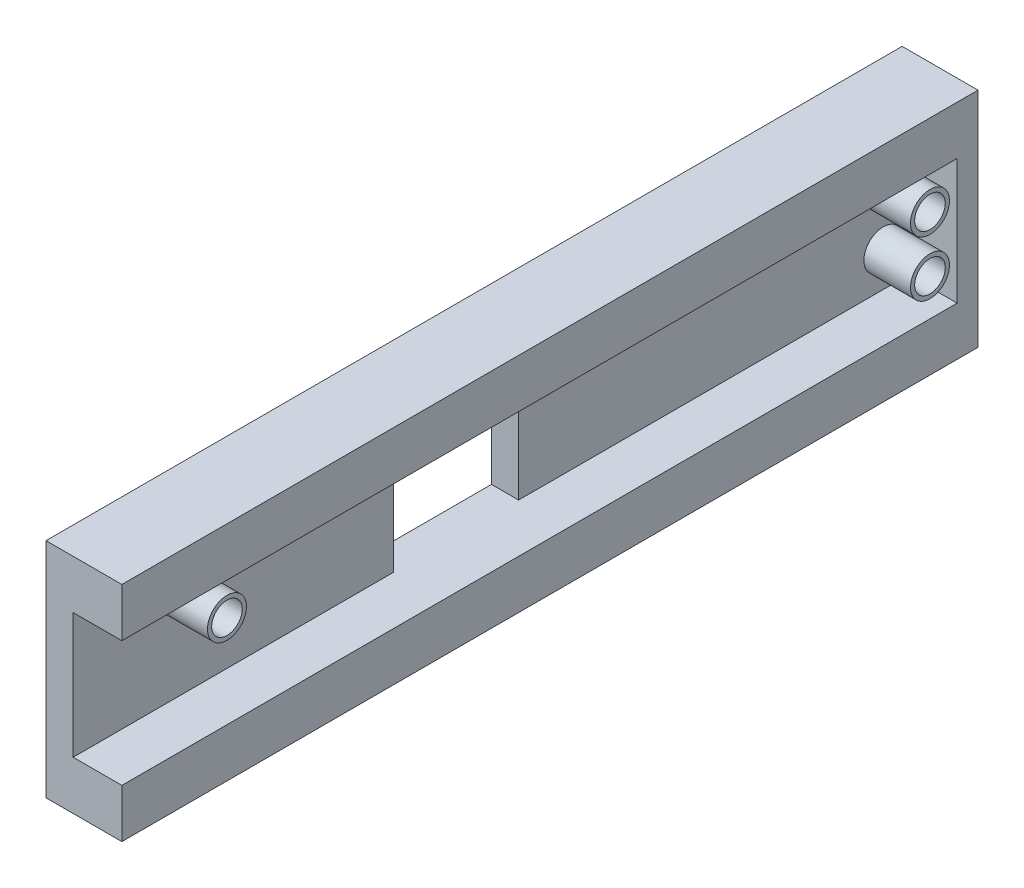
from build123d import *

# Parameters (mm, degrees)
SKETCH9_W           = 5.45
SKETCH9_H           = 61.5
BOSS_EXTRUDE3_DEPTH = 8
SKETCH11_W          = 3.5
SKETCH11_H          = 9
CUT_EXTRUDE1_DEPTH  = 63.257148184
SKETCH12_R          = 1.4
BOSS_EXTRUDE4_DEPTH = 5.3
SKETCH13_R          = 1.1
CUT_EXTRUDE2_DEPTH  = 33.212613989
SKETCH14_W          = 4.52927803
SKETCH14_H          = 16
BOSS_EXTRUDE5_DEPTH = 1.5
SKETCH15_W          = 9
SKETCH15_H          = 9
CUT_EXTRUDE3_DEPTH  = 33.237633288


with BuildPart() as part:
    # Sketch9 → Boss-Extrude3 (new, symmetric)
    with BuildSketch(Plane(origin=(0, 0, 0), x_dir=(1, 0, 0), z_dir=(0, 1, 0))):
        with Locations((-2.725, 0)):
            Rectangle(SKETCH9_W, SKETCH9_H)
    extrude(amount=BOSS_EXTRUDE3_DEPTH, both=True)

    # Sketch11 → Cut-Extrude1 (cut, through all)
    with BuildSketch(Plane.XY.offset(30.75)):
        with Locations((-1.75, 0)):
            Rectangle(SKETCH11_W, SKETCH11_H)
    extrude(amount=-CUT_EXTRUDE1_DEPTH, mode=Mode.SUBTRACT)

    # Sketch12 → Boss-Extrude4 (add)
    with BuildSketch(Plane.ZY.offset(5.45)):
        with Locations((-27.45, 2)):
            Circle(SKETCH12_R)
        with Locations((-27.45, -2)):
            Circle(SKETCH12_R)
        with Locations((23.05, 2)):
            Circle(SKETCH12_R)
    extrude(amount=-BOSS_EXTRUDE4_DEPTH)

    # Sketch13 → Cut-Extrude2 (cut, through all)
    with BuildSketch(Plane(origin=(-0.15, 0, 0), x_dir=(0, 0, -1), z_dir=(1, 0, 0))):
        with Locations((-23.05, 2)):
            Circle(SKETCH13_R)
        with Locations((27.45, 2)):
            Circle(SKETCH13_R)
        with Locations((27.45, -2)):
            Circle(SKETCH13_R)
    extrude(amount=-CUT_EXTRUDE2_DEPTH, mode=Mode.SUBTRACT)

    # Sketch14 → Boss-Extrude5 (add)
    with BuildSketch(Plane(origin=(0, 0, -30.75), x_dir=(-1, 0, 0), z_dir=(0, 0, -1))):
        with Locations((2.264639015, 0)):
            Rectangle(SKETCH14_W, SKETCH14_H)
    extrude(amount=-BOSS_EXTRUDE5_DEPTH)

    # Sketch15 → Cut-Extrude3 (cut, through all)
    with BuildSketch(Plane.ZY.offset(5.45)):
        with Locations((3.25, 0)):
            Rectangle(SKETCH15_W, SKETCH15_H)
    extrude(amount=-CUT_EXTRUDE3_DEPTH, mode=Mode.SUBTRACT)


solid = part.part
